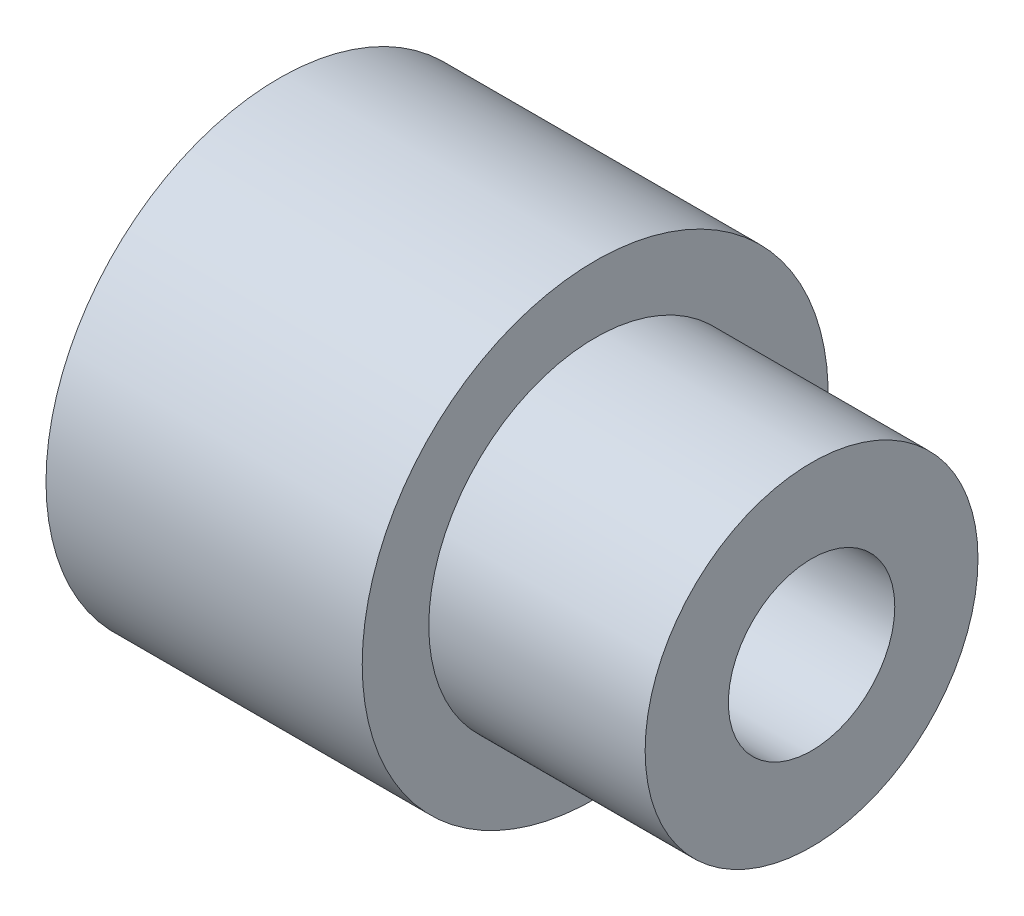
from build123d import *

# Parameters (mm, degrees)
SKETCH1_R           = 10
BOSS_EXTRUDE1_DEPTH = 13
SKETCH2_R           = 14
BOSS_EXTRUDE2_DEPTH = 19
SKETCH3_R           = 11
CUT_EXTRUDE1_DEPTH  = 6
SKETCH4_R           = 9
CUT_EXTRUDE2_DEPTH  = 10
SKETCH5_R           = 5
CUT_EXTRUDE3_DEPTH  = 38.629775444
FILLET1_R           = 0.05


with BuildPart() as part:
    # Sketch1 → Boss-Extrude1 (new body)
    with BuildSketch(Plane(origin=(0, 0, 0), x_dir=(0, 0, -1), z_dir=(1, 0, 0))):
        Circle(SKETCH1_R)
    extrude(amount=-BOSS_EXTRUDE1_DEPTH)

    # Sketch2 → Boss-Extrude2 (add)
    with BuildSketch(Plane.ZY.offset(13)):
        Circle(SKETCH2_R)
    extrude(amount=BOSS_EXTRUDE2_DEPTH)

    # Sketch3 → Cut-Extrude1 (cut)
    with BuildSketch(Plane.ZY.offset(32)):
        Circle(SKETCH3_R)
    extrude(amount=-CUT_EXTRUDE1_DEPTH, mode=Mode.SUBTRACT)

    # Sketch4 → Cut-Extrude2 (cut)
    with BuildSketch(Plane.ZY.offset(26)):
        Circle(SKETCH4_R)
    extrude(amount=-CUT_EXTRUDE2_DEPTH, mode=Mode.SUBTRACT)

    # Sketch5 → Cut-Extrude3 (cut, through all)
    with BuildSketch(Plane(origin=(0, 0, 0), x_dir=(0, 0, -1), z_dir=(1, 0, 0))):
        Circle(SKETCH5_R)
    extrude(amount=-CUT_EXTRUDE3_DEPTH, mode=Mode.SUBTRACT)

    # Fillet1
    fillet1_edges = [part.edges().sort_by_distance(p)[0] for p in [
        (-32, 0, -11),
    ]]
    fillet(fillet1_edges, radius=FILLET1_R)


solid = part.part
